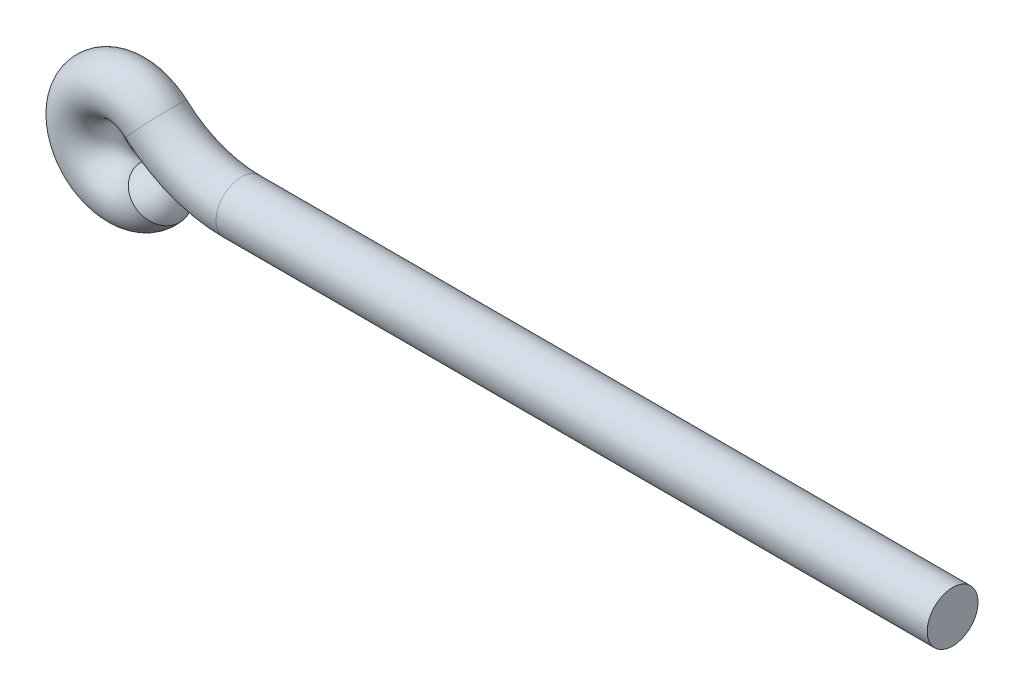
from build123d import *

# Parameters (mm, degrees)
SWEEP3_PROFILE_R    = 1.27
DOME1_FACE_RADIUS   = 1.27
DOME1_HEIGHT        = 0.889
SKETCH61_R          = 1.27
BOSS_EXTRUDE2_DEPTH = 30.48
SCALE1_SCALE        = 12.375


with BuildPart() as part:
    # Sweep3: sweep along a path in Sketch40
    with BuildLine(Plane.XY) as sweep3_path:
        Line((10.838928394, 0), (5.758928394, 0))
        ThreePointArc((5.758928394, 0), (3.472667092, 0.425853711), (1.49305551, 1.646296296))
        ThreePointArc((1.49305551, 1.646296296), (-2.217360492, -0.151058595), (1.702533775, -1.428595463))
    # Sweep3 profile (on start of the path) → Sweep3 (sweep)
    with BuildSketch(Plane(origin=(10.838928394, 0, 0), x_dir=(0, 0, -1), z_dir=(-1, 0, 0))):
        Circle(SWEEP3_PROFILE_R)
    sweep(path=sweep3_path.line)

    # Dome1: a dome of height H over a round flat face of radius A is a cap of a sphere of radius (A * A + H * H) / (2 * H)
    dome1_r = (DOME1_FACE_RADIUS * DOME1_FACE_RADIUS + DOME1_HEIGHT * DOME1_HEIGHT) / (2 * DOME1_HEIGHT)
    dome1_base = Plane((1.702533775, -1.428595463, 0), z_dir=(0.642787609687, 0.766044443119, 0))
    with Locations(dome1_base.offset(DOME1_HEIGHT - dome1_r)):
        dome1_ball = Sphere(dome1_r, mode=Mode.PRIVATE)
    add(split(dome1_ball, bisect_by=dome1_base, keep=Keep.TOP, mode=Mode.PRIVATE))

    # Sketch61 → Boss-Extrude2 (add)
    with BuildSketch(Plane(origin=(10.838928394, 0, 0), x_dir=(0, 0, -1), z_dir=(1, 0, 0))):
        Circle(SKETCH61_R)
    extrude(amount=BOSS_EXTRUDE2_DEPTH)


with BuildPart() as part_1:
    # Scale1: scaled about (16.50671912, 0.023905417, 0)
    add(part.part.scale(SCALE1_SCALE).moved(Location((-187.76392999, -0.271924118, 0))))


solid = part_1.part
